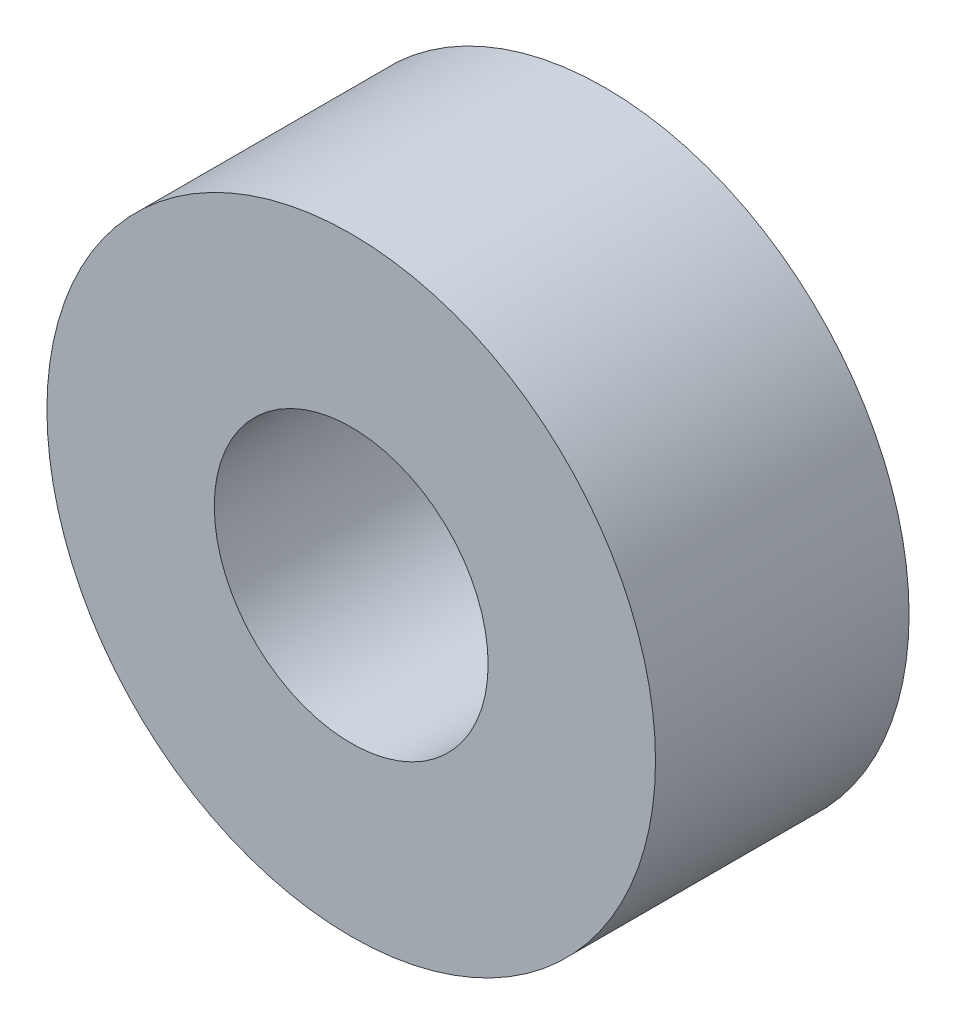
from build123d import *

# Parameters (mm, degrees)
SKETCH1_R           = 3
SKETCH1_R_2         = 1.35
BOSS_EXTRUDE1_DEPTH = 2.5


with BuildPart() as part:
    # Sketch1 → Boss-Extrude1 (new body)
    with BuildSketch(Plane.XY):
        Circle(SKETCH1_R)
        Circle(SKETCH1_R_2, mode=Mode.SUBTRACT)
    extrude(amount=BOSS_EXTRUDE1_DEPTH)


solid = part.part
